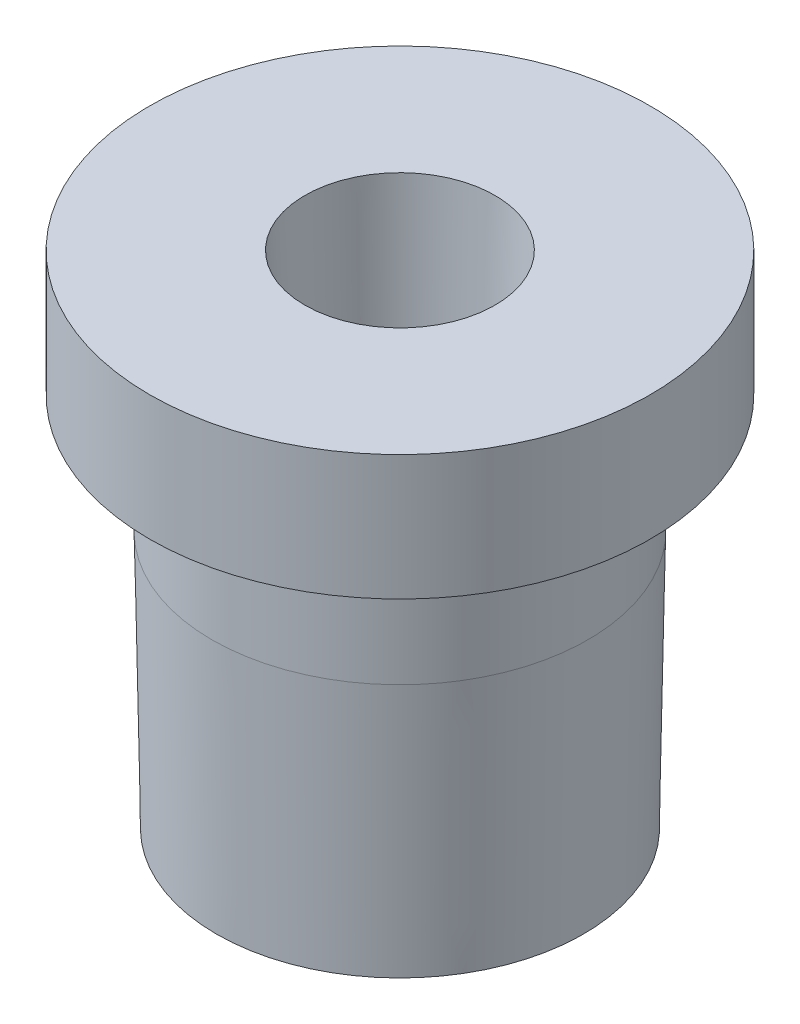
from build123d import *

# Parameters (mm, degrees)
SKETCH1_R                = 9.54278
BOSS_EXTRUDE1_DEPTH      = 25.4
SKETCH2_R                = 12.7
BOSS_EXTRUDE2_DEPTH      = 6.35
R_0_339_DIAMETER_HOLE1_D = 8.6106


with BuildPart() as part:
    # Sketch1 → Boss-Extrude1 (new body)
    with BuildSketch(Plane(origin=(0, 0, 0), x_dir=(1, 0, 0), z_dir=(0, 1, 0))):
        with Locations(Location((0, 0, 0), (0, 0, 270))):
            Circle(SKETCH1_R)
    extrude(amount=BOSS_EXTRUDE1_DEPTH)

    # Sketch2 → Boss-Extrude2 (add)
    with BuildSketch(Plane(origin=(0, 25.4, 0), x_dir=(1, 0, 0), z_dir=(0, 1, 0))):
        with Locations(Location((0, 0, 0), (0, 0, 270))):
            Circle(SKETCH2_R)
    extrude(amount=-BOSS_EXTRUDE2_DEPTH)

    # R (0.339) Diameter Hole1 (through all)
    with Locations(Plane(origin=(0, 25.4, 0), x_dir=(1, 0, 0), z_dir=(0, 1, 0))):
        with Locations((0, 0)):
            Hole(R_0_339_DIAMETER_HOLE1_D / 2)

    # Sketch4 → 1/8 NPT Tapped Hole1 (revolve, cut)
    with BuildSketch(Plane(origin=(0, 25.4, 0), x_dir=(0, 0, 1), z_dir=(1, 0, 0))):
        Polygon((0, 0), (0, 14.478), (4.2164, 11.944531286), (4.2164, 9.652), (4.537399894, 9.652), (4.8263937, 0), align=None)
    revolve(axis=Axis((0, 31.75, 0), (0, -1, 0)), mode=Mode.SUBTRACT)

    # Sketch6 → 1/8 NPT Tapped Hole2 (revolve, cut)
    with BuildSketch(Plane(origin=(0, 0, 0), x_dir=(0, 0, -1), z_dir=(1, 0, 0))):
        Polygon((0, 0), (0, 14.478), (4.2164, 11.944531286), (4.2164, 9.652), (4.537399894, 9.652), (4.8263937, 0), align=None)
    revolve(axis=Axis((0, -6.35, 0), (0, 1, 0)), mode=Mode.SUBTRACT)

    # Sketch9 → Cut-Revolve1 (revolve, cut)
    with BuildSketch(Plane(origin=(0, 0, 0), x_dir=(0, 0, -1), z_dir=(1, 0, 0))):
        Polygon((-9.314991403, 0), (-9.54278, 13.05), (-9.54278, 0), align=None)
    revolve(axis=Axis((0, 19.05, 0), (0, -1, 0)), mode=Mode.SUBTRACT)


solid = part.part
